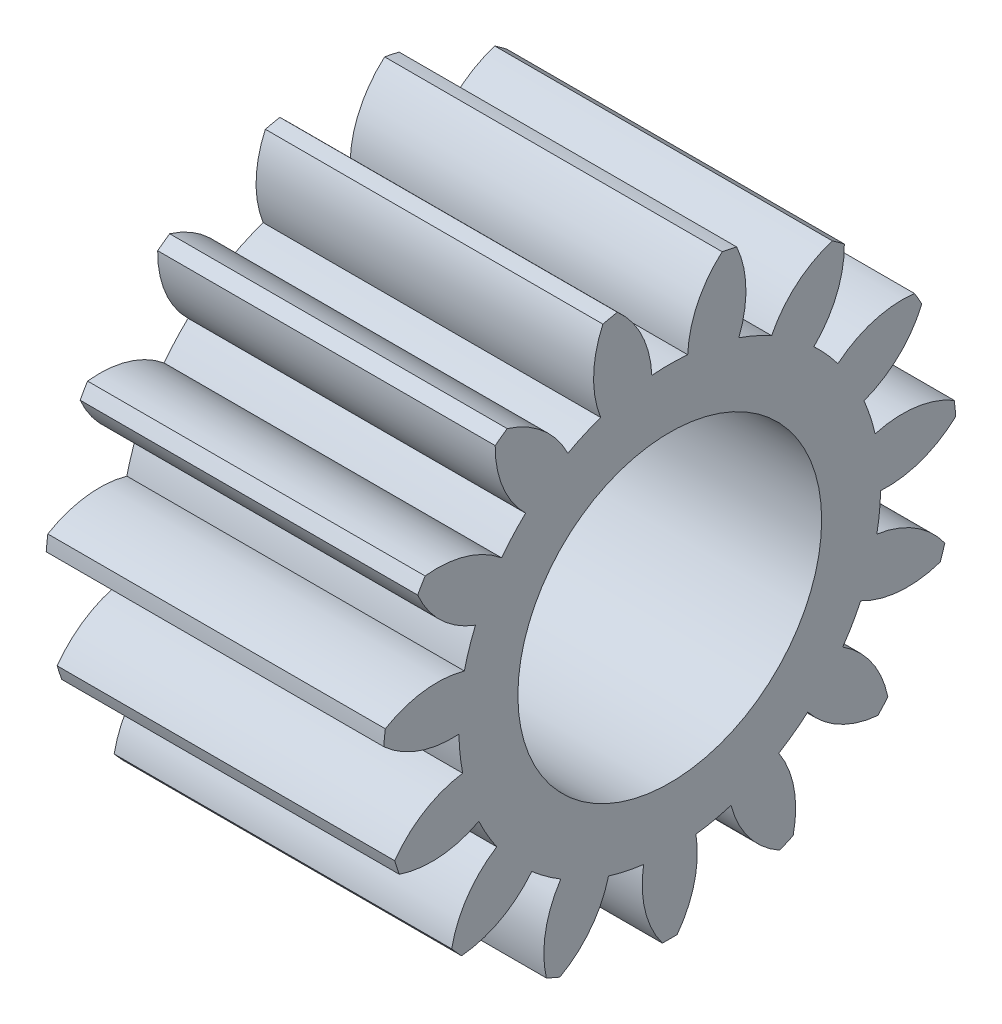
from build123d import *

# Parameters (mm, degrees)
BASPROSKE_W     = 5
BASPROSKE_H     = 4.25
TOOTHCUT_DEPTH  = 8.818247886
TEETHCUTS_COUNT = 15
TEETHCUTS_ANGLE = 336
BORSKE_R        = 2.25
BORE_DEPTH      = 50.0003048


with BuildPart() as part:
    # BasProSke → Base-Revolve (revolve)
    with BuildSketch(Plane(origin=(0, 0, 0), x_dir=(1, 0, 0), z_dir=(0, 1, 0)), mode=Mode.PRIVATE) as base_revolve_sk:
        with Locations((2.5, 2.125)):
            Rectangle(BASPROSKE_W, BASPROSKE_H)
    revolve(base_revolve_sk.sketch.rotate(Axis((-10, 0, 0), (1, 0, 0)), 180), axis=Axis((-10, 0, 0), (1, 0, 0)))

    # TooCutSke → ToothCut (cut, through all)
    with BuildSketch(Plane(origin=(0, 0, 0), x_dir=(0, 0, -1), z_dir=(1, 0, 0))):
        with BuildLine():
            ThreePointArc((0.265767165, 3.112674704), (0, 3.124), (-0.265767165, 3.112674704))
            ThreePointArc((-0.265767165, 3.112674704), (-0.418628877, 3.712626775), (-0.800767345, 4.19974009))
            ThreePointArc((-0.800767345, 4.19974009), (0, 4.2754), (0.800767345, 4.19974009))
            ThreePointArc((0.800767345, 4.19974009), (0.418628877, 3.712626775), (0.265767165, 3.112674704))
        make_face()
    toothcut = extrude(amount=TOOTHCUT_DEPTH, mode=Mode.SUBTRACT)

    # TeethCuts: ToothCut ×15 about axis
    teethcuts_axis = Axis((-10, 0, 0), (1, 0, 0))
    for i in range(1, TEETHCUTS_COUNT):
        add(toothcut.rotate(teethcuts_axis, i * TEETHCUTS_ANGLE / (TEETHCUTS_COUNT - 1)), mode=Mode.SUBTRACT)

    # BorSke → Bore (cut, symmetric)
    with BuildSketch(Plane(origin=(0, 0, 0), x_dir=(0, 0, -1), z_dir=(1, 0, 0))):
        with Locations(Location((0, 0, 0), (0, 0, 180))):
            Circle(BORSKE_R)
    extrude(amount=BORE_DEPTH, both=True, mode=Mode.SUBTRACT)


solid = part.part
